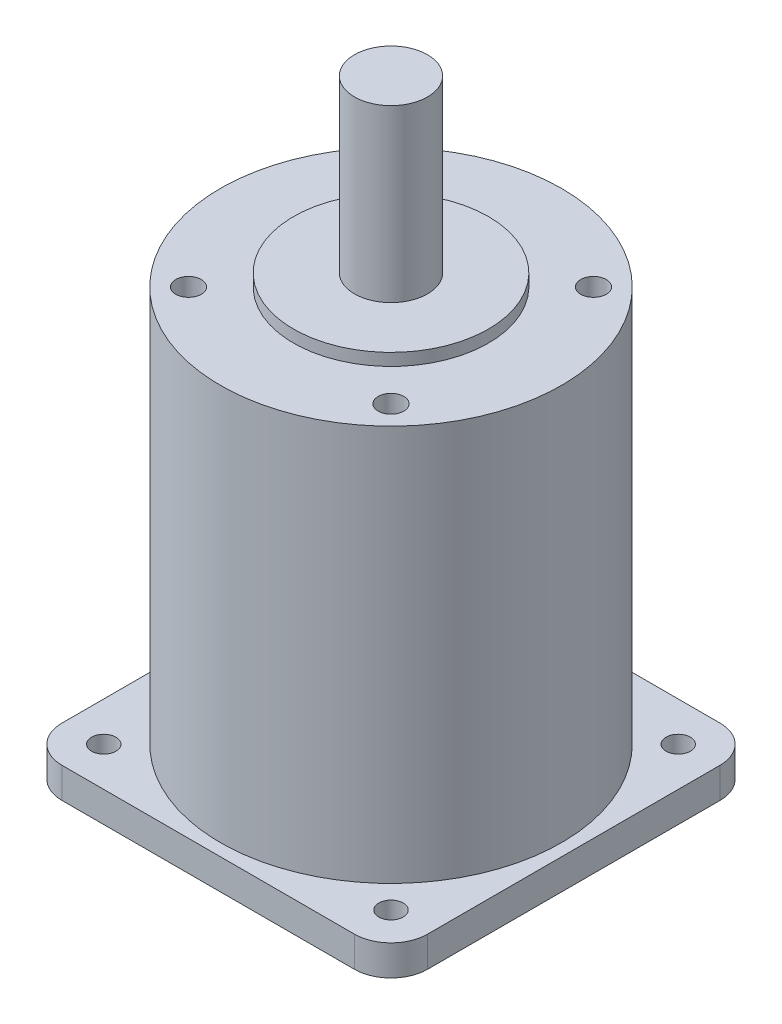
from build123d import *

# Parameters (mm, degrees)
ESQUISSE2_W             = 60
ESQUISSE2_H             = 60
BOSS_EXTRU_1_DEPTH      = 5
ESQUISSE3_R             = 2
ENL_V_MAT_EXTRU_1_DEPTH = 5
CONG_1_R                = 6
TROU_TARAUD_M51_D       = 4.2
TROU_TARAUD_M51_DEPTH   = 24
TROU_TARAUD_M51_TIP     = 1.2618073


with BuildPart() as part:
    # Esquisse1 → Révolution1 (revolve)
    with BuildSketch(Plane.XY, mode=Mode.PRIVATE) as r_volution1_sk:
        Polygon((0, 0), (28, 0), (28, 65), (16, 65), (16, 67), (6, 67), (6, 95), (0, 95), align=None)
    revolve(r_volution1_sk.sketch.rotate(Axis((0, 0, 0), (0, 1, 0)), 90), axis=Axis((0, 0, 0), (0, 1, 0)))

    # Esquisse2 → Boss.-Extru.1 (add)
    with BuildSketch(Plane.XZ):
        Rectangle(ESQUISSE2_W, ESQUISSE2_H)
    extrude(amount=BOSS_EXTRU_1_DEPTH)

    # Esquisse3 → Enlèv. mat.-Extru.1 (cut)
    with BuildSketch(Plane.XZ.offset(5)):
        with Locations(Location((-23.57, 23.57, 0), (0, 0, 270))):
            Circle(ESQUISSE3_R)
        with Locations(Location((23.57, 23.57, 0), (0, 0, 270))):
            Circle(ESQUISSE3_R)
        with Locations(Location((-23.57, -23.57, 0), (0, 0, 270))):
            Circle(ESQUISSE3_R)
        with Locations(Location((23.57, -23.57, 0), (0, 0, 270))):
            Circle(ESQUISSE3_R)
    extrude(amount=-ENL_V_MAT_EXTRU_1_DEPTH, mode=Mode.SUBTRACT)

    # Congé1
    cong_1_edges = [part.edges().sort_by_distance(p)[0] for p in [
        (-30, -2.5, 30),
        (-30, -2.5, -30),
        (30, -2.5, -30),
        (30, -2.5, 30),
    ]]
    fillet(cong_1_edges, radius=CONG_1_R)

    # Trou taraudé M51
    with Locations(Plane(origin=(0, 65, 0), x_dir=(1, 0, 0), z_dir=(0, 1, 0))):
        with Locations((-16.617009358, 16.617009358), (16.617009358, 16.617009358), (16.617009358, -16.617009358), (-16.617009358, -16.617009358)):
            Hole(TROU_TARAUD_M51_D / 2, depth=TROU_TARAUD_M51_DEPTH)
            with Locations((0, 0, -(TROU_TARAUD_M51_DEPTH + TROU_TARAUD_M51_TIP / 2))):  # 118° drill point
                Cone(0, TROU_TARAUD_M51_D / 2, TROU_TARAUD_M51_TIP, mode=Mode.SUBTRACT)


solid = part.part
